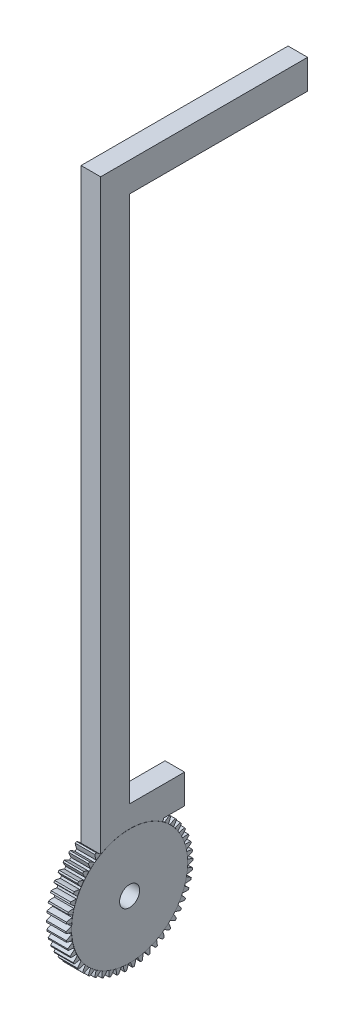
from build123d import *

# Parameters (mm, degrees)
BASPROSKE_W         = 2
BASPROSKE_H         = 6.5
TOOTHCUT_DEPTH      = 10.407443861
TEETHCUTS_COUNT     = 50
TEETHCUTS_ANGLE     = 352.8
BORSKE_R            = 0.5
BORE_DEPTH          = 50.0000508
BOSS_EXTRUDE1_DEPTH = 2
SKETCH2_R           = 1.025
CUT_EXTRUDE1_DEPTH  = 10
SKETCH3_R           = 5.9365
SKETCH3_R_2         = 1.025
BOSS_EXTRUDE2_DEPTH = 0.01


with BuildPart() as part:
    # BasProSke → Base-Revolve (revolve)
    with BuildSketch(Plane(origin=(0, 0, 0), x_dir=(1, 0, 0), z_dir=(0, 1, 0)), mode=Mode.PRIVATE) as base_revolve_sk:
        with Locations((1, 3.25)):
            Rectangle(BASPROSKE_W, BASPROSKE_H)
    revolve(base_revolve_sk.sketch.rotate(Axis((-10, 0, 0), (1, 0, 0)), 180), axis=Axis((-10, 0, 0), (1, 0, 0)))

    # TooCutSke → ToothCut (cut, through all)
    with BuildSketch(Plane(origin=(0, 0, 0), x_dir=(0, 0, -1), z_dir=(1, 0, 0))):
        with BuildLine():
            ThreePointArc((0.106726021, 5.935540566), (0, 5.9365), (-0.106726021, 5.935540566))
            ThreePointArc((-0.106726021, 5.935540566), (-0.20502053, 6.233368102), (-0.339830902, 6.516545106))
            ThreePointArc((-0.339830902, 6.516545106), (0, 6.5254), (0.339830902, 6.516545106))
            ThreePointArc((0.339830902, 6.516545106), (0.20502053, 6.233368102), (0.106726021, 5.935540566))
        make_face()
    toothcut = extrude(amount=TOOTHCUT_DEPTH, mode=Mode.SUBTRACT)

    # TeethCuts: ToothCut ×50 about axis
    teethcuts_axis = Axis((-10, 0, 0), (1, 0, 0))
    for i in range(1, TEETHCUTS_COUNT):
        add(toothcut.rotate(teethcuts_axis, i * TEETHCUTS_ANGLE / (TEETHCUTS_COUNT - 1)), mode=Mode.SUBTRACT)

    # BorSke → Bore (cut, symmetric)
    with BuildSketch(Plane(origin=(0, 0, 0), x_dir=(0, 0, -1), z_dir=(1, 0, 0))):
        with Locations(Location((0, 0, 0), (0, 0, 180))):
            Circle(BORSKE_R)
    extrude(amount=BORE_DEPTH, both=True, mode=Mode.SUBTRACT)

    # Sketch1 → Boss-Extrude1 (add)
    with BuildSketch(Plane(origin=(2, 0, 0), x_dir=(0, 0, -1), z_dir=(1, 0, 0))):
        Polygon((-2.952993201, 5.149938194), (3.25269317, 5.149938194), (5.631250781, 5.149938194), (5.631250781, 8.149938194), (2.706093524, 8.149938194), (0, 8.149938194), (0, 62.149938194), (12.757466939, 62.149938194), (18.208861891, 62.149938194), (18.208861891, 65.149938194), (11.576049668, 65.149938194), (-2.952993201, 65.149938194), align=None)
    extrude(amount=-BOSS_EXTRUDE1_DEPTH)

    # Sketch2 → Cut-Extrude1 (cut)
    with BuildSketch(Plane(origin=(2, 0, 0), x_dir=(0, 0, -1), z_dir=(1, 0, 0))):
        Circle(SKETCH2_R)
    extrude(amount=-CUT_EXTRUDE1_DEPTH, mode=Mode.SUBTRACT)

    # Sketch3 → Boss-Extrude2 (add)
    with BuildSketch(Plane(origin=(2, 0, 0), x_dir=(0, 0, -1), z_dir=(1, 0, 0))):
        with Locations(Location((0, 0, 0), (0, 0, 177.430115394))):
            Circle(SKETCH3_R)
        Circle(SKETCH3_R_2, mode=Mode.SUBTRACT)
    extrude(amount=BOSS_EXTRUDE2_DEPTH)


solid = part.part
